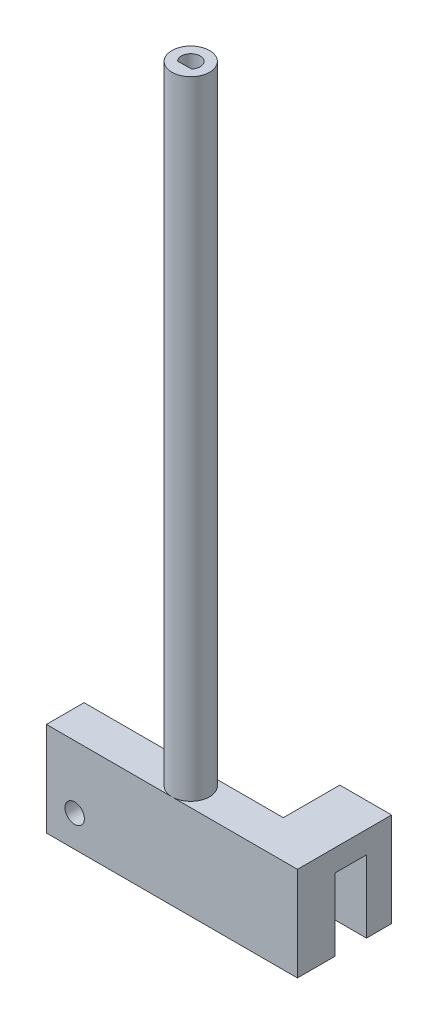
from build123d import *

# Parameters (mm, degrees)
SKETCH1_R           = 3
BOSS_EXTRUDE1_DEPTH = 100
CUT_EXTRUDE1_DEPTH  = 6
SKETCH3_W           = 40
SKETCH3_H           = 6
BOSS_EXTRUDE2_DEPTH = 15
SKETCH4_R           = 1.55
CUT_EXTRUDE2_DEPTH  = 103.156742313
SKETCH6_W           = 8.25
SKETCH6_H           = 15
BOSS_EXTRUDE3_DEPTH = 9
SKETCH7_W           = 8.25
SKETCH7_H           = 5
CUT_EXTRUDE3_DEPTH  = 11.5


with BuildPart() as part:
    # Sketch1 → Boss-Extrude1 (new body)
    with BuildSketch(Plane(origin=(0, 0, 0), x_dir=(1, 0, 0), z_dir=(0, 1, 0))):
        with Locations(Location((0, 0, 0), (0, 0, 270))):
            Circle(SKETCH1_R)
    extrude(amount=BOSS_EXTRUDE1_DEPTH)

    # Sketch2 → Cut-Extrude1 (cut)
    with BuildSketch(Plane(origin=(0, 100, 0), x_dir=(1, 0, 0), z_dir=(0, 1, 0))):
        with BuildLine():
            Line((-1.101332519, -1.01836471), (1.134429265, -0.981361423))
            ThreePointArc((1.134429265, -0.981361423), (-0.02482256, 1.499794599), (-1.101332519, -1.01836471))
        make_face()
    extrude(amount=-CUT_EXTRUDE1_DEPTH, mode=Mode.SUBTRACT)

    # Sketch3 → Boss-Extrude2 (add)
    with BuildSketch(Plane.XZ):
        Rectangle(SKETCH3_W, SKETCH3_H)
    extrude(amount=BOSS_EXTRUDE2_DEPTH)

    # Sketch4 → Cut-Extrude2 (cut, through all)
    with BuildSketch(Plane(origin=(0, 0, -3), x_dir=(-1, 0, 0), z_dir=(0, 0, -1))):
        with Locations((15.5, -10)):
            Circle(SKETCH4_R)
    extrude(amount=-CUT_EXTRUDE2_DEPTH, mode=Mode.SUBTRACT)

    # Sketch6 → Boss-Extrude3 (add)
    with BuildSketch(Plane(origin=(0, 0, -3), x_dir=(-1, 0, 0), z_dir=(0, 0, -1))):
        with Locations((-15.875, -7.5)):
            Rectangle(SKETCH6_W, SKETCH6_H)
    extrude(amount=BOSS_EXTRUDE3_DEPTH)

    # Sketch7 → Cut-Extrude3 (cut)
    with BuildSketch(Plane.XZ.offset(15)):
        with Locations((15.875, -5.5)):
            Rectangle(SKETCH7_W, SKETCH7_H)
    extrude(amount=-CUT_EXTRUDE3_DEPTH, mode=Mode.SUBTRACT)


solid = part.part
